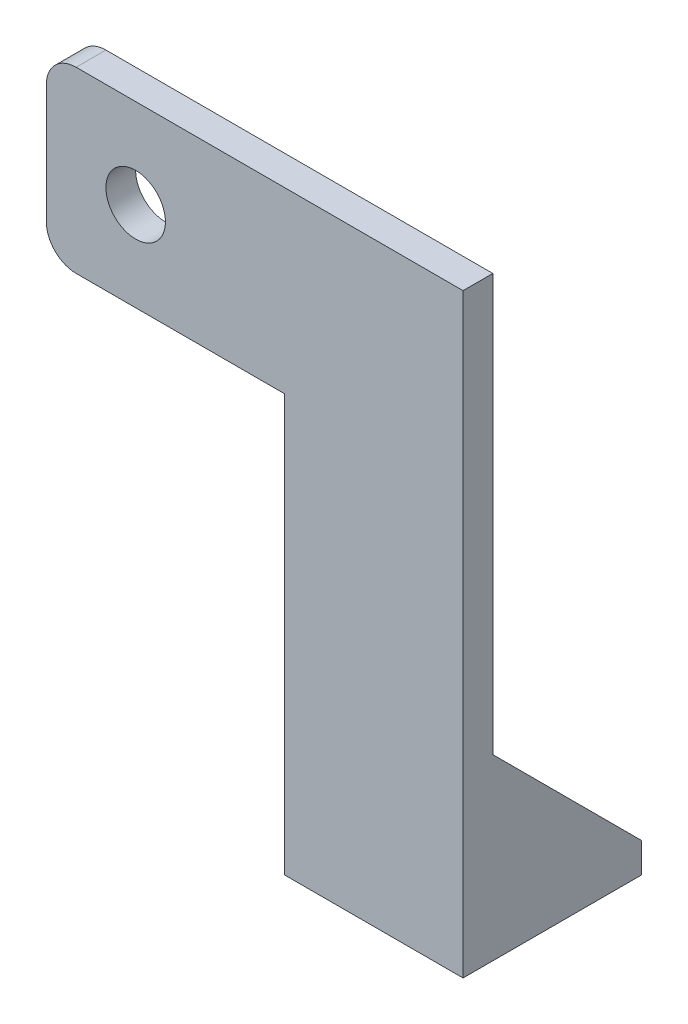
from build123d import *

# Parameters (mm, degrees)
BOSS_EXTRUDE1_DEPTH = 5
SKETCH4_R           = 5
CUT_EXTRUDE1_DEPTH  = 5
SKETCH5_W           = 30
SKETCH5_H           = 30
BOSS_EXTRUDE4_DEPTH = 5
BOSS_EXTRUDE5_DEPTH = 5


with BuildPart() as part:
    # Sketch1 → Boss-Extrude1 (new body)
    with BuildSketch(Plane.XY):
        with BuildLine():
            Line((5, 0), (70, 0))
            Line((70, 0), (70, -30))
            Line((70, -30), (70, -95))
            Line((70, -95), (40, -95))
            Line((40, -95), (40, -30))
            Line((40, -30), (5, -30))
            ThreePointArc((5, -30), (1.464466094, -28.535533906), (0, -25))
            Line((0, -25), (0, -5))
            ThreePointArc((0, -5), (1.464466094, -1.464466094), (5, 0))
        make_face()
    extrude(amount=BOSS_EXTRUDE1_DEPTH)

    # Sketch4 → Cut-Extrude1 (cut)
    with BuildSketch(Plane.XY.offset(5)):
        with Locations((15, -15)):
            Circle(SKETCH4_R)
    extrude(amount=-CUT_EXTRUDE1_DEPTH, mode=Mode.SUBTRACT)

    # Sketch5 → Boss-Extrude4 (add)
    with BuildSketch(Plane.XZ.offset(95)):
        with Locations((55, -10)):
            Rectangle(SKETCH5_W, SKETCH5_H)
    extrude(amount=BOSS_EXTRUDE4_DEPTH)

    # Sketch6 → Boss-Extrude5 (add)
    with BuildSketch(Plane(origin=(70, 0, 0), x_dir=(0, 0, -1), z_dir=(1, 0, 0))):
        Polygon((0, -70), (25, -95), (0, -95), align=None)
    boss_extrude5 = extrude(amount=-BOSS_EXTRUDE5_DEPTH)

    # Mirror2: Boss-Extrude5 across plane
    add(boss_extrude5.mirror(Plane.ZY.offset(-55)))


solid = part.part
